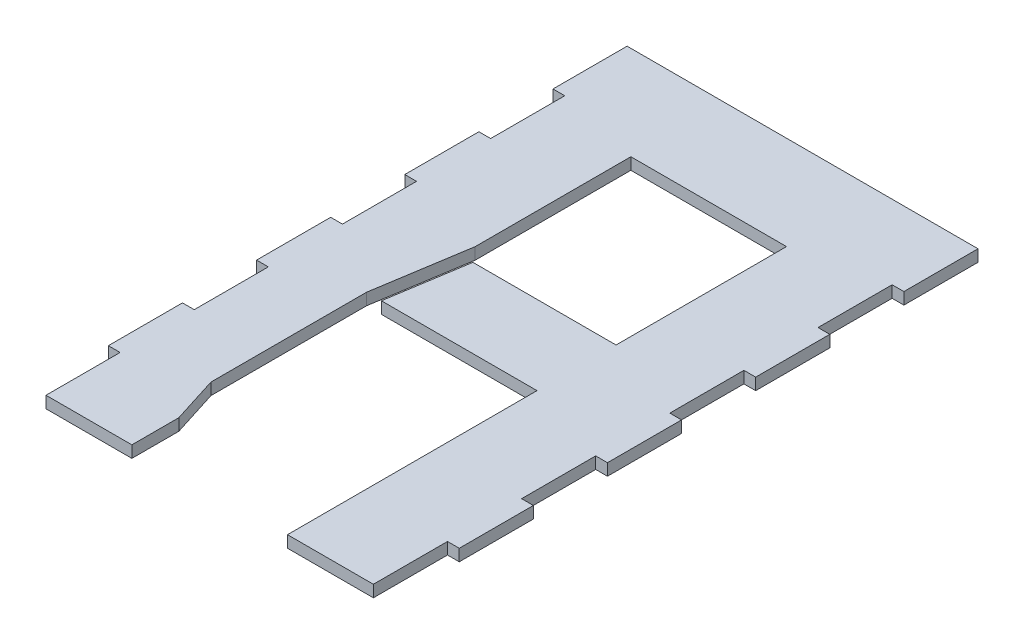
from build123d import *

# Parameters (mm, degrees)
BOSS_EXTRUDE1_DEPTH = 3.175
SKETCH3_W           = 15
SKETCH3_H           = 20
SKETCH3_R           = 3.5
BOSS_EXTRUDE3_DEPTH = 3.175
SKETCH4_W           = 23.175
SKETCH4_H           = 6.096
BOSS_EXTRUDE4_DEPTH = 3.175
SKETCH5_W           = 11.825
SKETCH5_H           = 166.096
CUT_EXTRUDE1_DEPTH  = 191.502764088
SKETCH6_W           = 88.35
SKETCH6_H           = 6.096
CUT_EXTRUDE2_DEPTH  = 185.355380312


with BuildPart() as part:
    # Sketch1 → Boss-Extrude1 (new body)
    with BuildSketch(Plane(origin=(0, 0, 0), x_dir=(1, 0, 0), z_dir=(0, 1, 0))):
        Polygon((0, 160), (0, 0), (23.175, 0), (23.175, 12.666666667), (19.175, 25.333333333), (19.175, 67.333333333), (23.175, 92.666666667), (23.175, 134.666666667), (65.175, 134.666666667), (65.175, 92.666666667), (65.175, 88.666666667), (26.543421053, 88.666666667), (23.175, 67.333333333), (65.175, 67.333333333), (65.175, 25.333333333), (65.175, 0), (88.35, 0), (88.35, 160), align=None)
    extrude(amount=BOSS_EXTRUDE1_DEPTH)

    # Sketch3 → Boss-Extrude3 (add)
    # profile 1 of 8: a face of its own
    with BuildSketch(Plane(origin=(0, 3.175, 0), x_dir=(1, 0, 0), z_dir=(0, 1, 0))):
        with Locations((-7.5, 150)):
            Rectangle(SKETCH3_W, SKETCH3_H)
        with Locations(Location((-7.5, 150, 0), (0, 0, 270))):
            Circle(SKETCH3_R, mode=Mode.SUBTRACT)
    # profile 2 of 8: a face of its own
    with BuildSketch(Plane(origin=(0, 3.175, 0), x_dir=(1, 0, 0), z_dir=(0, 1, 0))):
        with Locations((-7.5, 110)):
            Rectangle(SKETCH3_W, SKETCH3_H)
        with Locations(Location((-7.5, 110, 0), (0, 0, 270))):
            Circle(SKETCH3_R, mode=Mode.SUBTRACT)
    # profile 3 of 8: a face of its own
    with BuildSketch(Plane(origin=(0, 3.175, 0), x_dir=(1, 0, 0), z_dir=(0, 1, 0))):
        with Locations((-7.5, 70)):
            Rectangle(SKETCH3_W, SKETCH3_H)
        with Locations(Location((-7.5, 70, 0), (0, 0, 270))):
            Circle(SKETCH3_R, mode=Mode.SUBTRACT)
    # profile 4 of 8: a face of its own
    with BuildSketch(Plane(origin=(0, 3.175, 0), x_dir=(1, 0, 0), z_dir=(0, 1, 0))):
        with Locations((-7.5, 30)):
            Rectangle(SKETCH3_W, SKETCH3_H)
        with Locations(Location((-7.5, 30, 0), (0, 0, 270))):
            Circle(SKETCH3_R, mode=Mode.SUBTRACT)
    # profile 5 of 8: a face of its own
    with BuildSketch(Plane(origin=(0, 3.175, 0), x_dir=(1, 0, 0), z_dir=(0, 1, 0))):
        with Locations((95.85, 30)):
            Rectangle(SKETCH3_W, SKETCH3_H)
        with Locations(Location((95.85, 30, 0), (0, 0, 270))):
            Circle(SKETCH3_R, mode=Mode.SUBTRACT)
    # profile 6 of 8: a face of its own
    with BuildSketch(Plane(origin=(0, 3.175, 0), x_dir=(1, 0, 0), z_dir=(0, 1, 0))):
        with Locations((95.85, 70)):
            Rectangle(SKETCH3_W, SKETCH3_H)
        with Locations(Location((95.85, 70, 0), (0, 0, 270))):
            Circle(SKETCH3_R, mode=Mode.SUBTRACT)
    # profile 7 of 8: a face of its own
    with BuildSketch(Plane(origin=(0, 3.175, 0), x_dir=(1, 0, 0), z_dir=(0, 1, 0))):
        with Locations((95.85, 110)):
            Rectangle(SKETCH3_W, SKETCH3_H)
        with Locations(Location((95.85, 110, 0), (0, 0, 270))):
            Circle(SKETCH3_R, mode=Mode.SUBTRACT)
    # profile 8 of 8: a face of its own
    with BuildSketch(Plane(origin=(0, 3.175, 0), x_dir=(1, 0, 0), z_dir=(0, 1, 0))):
        with Locations((95.85, 150)):
            Rectangle(SKETCH3_W, SKETCH3_H)
        with Locations(Location((95.85, 150, 0), (0, 0, 270))):
            Circle(SKETCH3_R, mode=Mode.SUBTRACT)
    extrude(amount=-BOSS_EXTRUDE3_DEPTH)

    # Sketch4 → Boss-Extrude4 (add)
    with BuildSketch(Plane(origin=(0, 3.175, 0), x_dir=(1, 0, 0), z_dir=(0, 1, 0))):
        with Locations((11.5875, -3.048)):
            Rectangle(SKETCH4_W, SKETCH4_H)
        with Locations((76.7625, -3.048)):
            Rectangle(SKETCH4_W, SKETCH4_H)
    extrude(amount=-BOSS_EXTRUDE4_DEPTH)

    # Sketch5 → Cut-Extrude1 (cut, through all)
    with BuildSketch(Plane(origin=(0, 3.175, 0), x_dir=(1, 0, 0), z_dir=(0, 1, 0))):
        with Locations((-9.0875, 76.952)):
            Rectangle(SKETCH5_W, SKETCH5_H)
        with Locations((97.4375, 76.952)):
            Rectangle(SKETCH5_W, SKETCH5_H)
    extrude(amount=-CUT_EXTRUDE1_DEPTH, mode=Mode.SUBTRACT)

    # Sketch6 → Cut-Extrude2 (cut, through all)
    with BuildSketch(Plane(origin=(0, 3.175, 0), x_dir=(1, 0, 0), z_dir=(0, 1, 0))):
        with Locations((44.175, -3.048)):
            Rectangle(SKETCH6_W, SKETCH6_H)
    extrude(amount=-CUT_EXTRUDE2_DEPTH, mode=Mode.SUBTRACT)


solid = part.part
